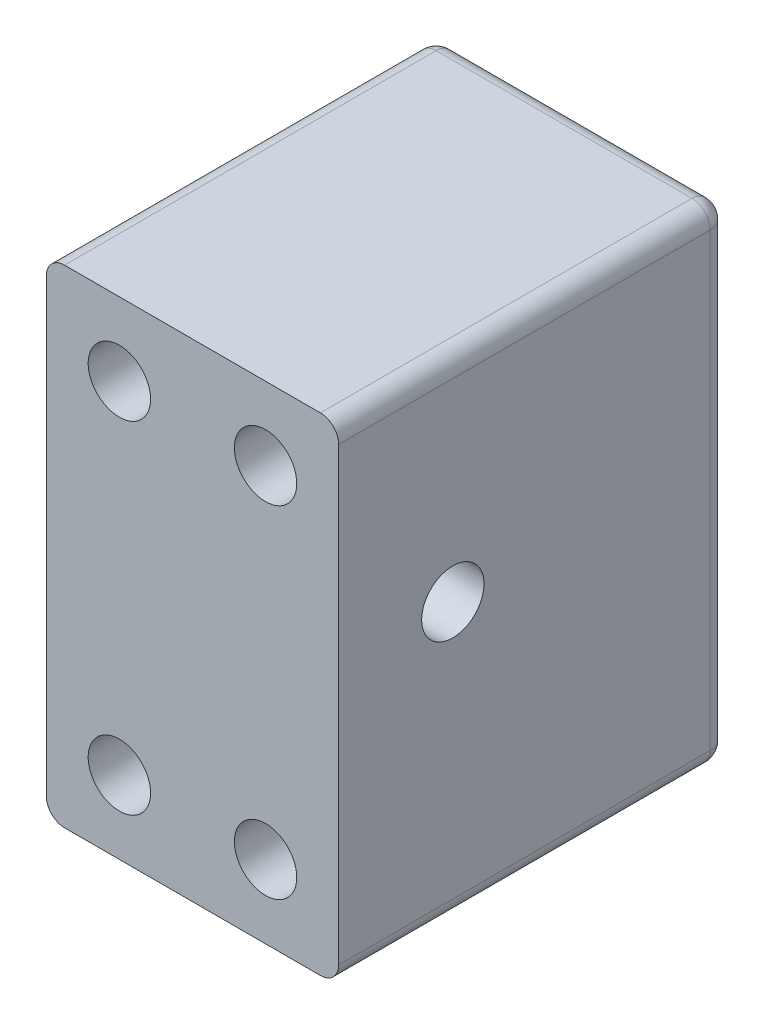
from build123d import *

# Parameters (mm, degrees)
SKETCH1_W           = 19.05
SKETCH1_H           = 31.75
SKETCH1_R           = 2.032
BOSS_EXTRUDE1_DEPTH = 25.4
SKETCH2_R           = 2.032
CUT_EXTRUDE1_DEPTH  = 45.901280605
FILLET1_R           = 1.190625


with BuildPart() as part:
    # Sketch1 → Boss-Extrude1 (new body)
    with BuildSketch(Plane.XY):
        with Locations((9.525, 15.875)):
            Rectangle(SKETCH1_W, SKETCH1_H)
        with Locations((4.7625, 26.9875)):
            Circle(SKETCH1_R, mode=Mode.SUBTRACT)
        with Locations((14.2875, 26.9875)):
            Circle(SKETCH1_R, mode=Mode.SUBTRACT)
        with Locations((4.7625, 4.7625)):
            Circle(SKETCH1_R, mode=Mode.SUBTRACT)
        with Locations((14.2875, 4.7625)):
            Circle(SKETCH1_R, mode=Mode.SUBTRACT)
    extrude(amount=BOSS_EXTRUDE1_DEPTH)

    # Sketch2 → Cut-Extrude1 (cut, through all)
    with BuildSketch(Plane.ZY):
        with Locations((17.960512242, 17.960512242)):
            Circle(SKETCH2_R)
    extrude(amount=-CUT_EXTRUDE1_DEPTH, mode=Mode.SUBTRACT)

    # Fillet1
    fillet1_edges = [part.edges().sort_by_distance(p)[0] for p in [
        (9.525, 31.75, 0),
        (19.05, 15.875, 0),
        (9.525, 0, 0),
        (0, 15.875, 0),
        (0, 31.75, 12.7),
        (19.05, 31.75, 12.7),
        (19.05, 0, 12.7),
        (0, 0, 12.7),
    ]]
    fillet(fillet1_edges, radius=FILLET1_R)


solid = part.part
